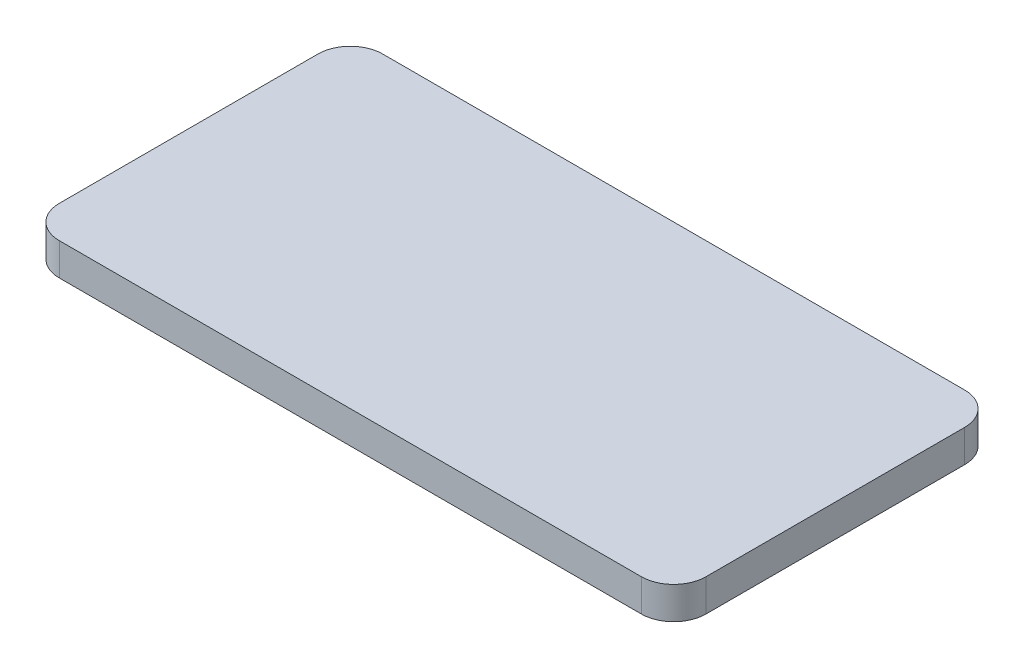
from build123d import *

# Parameters (mm, degrees)
BOSS_EXTRUDE1_DEPTH = 5
CUT_EXTRUDE1_DEPTH  = 1
SKETCH3_R           = 3.5
BOSS_EXTRUDE2_DEPTH = 2
CUT_EXTRUDE2_DEPTH  = 5


with BuildPart() as part:
    # Sketch1 → Boss-Extrude1 (new body)
    with BuildSketch(Plane(origin=(0, 0, 0), x_dir=(1, 0, 0), z_dir=(0, 1, 0))):
        with BuildLine():
            Line((-45, -25), (45, -25))
            ThreePointArc((45, -25), (48.535533906, -23.535533906), (50, -20))
            Line((50, -20), (50, 20))
            ThreePointArc((50, 20), (48.535533906, 23.535533906), (45, 25))
            Line((45, 25), (-45, 25))
            ThreePointArc((-45, 25), (-48.535533906, 23.535533906), (-50, 20))
            Line((-50, 20), (-50, -20))
            ThreePointArc((-50, -20), (-48.535533906, -23.535533906), (-45, -25))
        make_face()
    extrude(amount=BOSS_EXTRUDE1_DEPTH)

    # Sketch2 → Cut-Extrude1 (cut)
    with BuildSketch(Plane(origin=(0, 0, 0), x_dir=(-1, 0, 0), z_dir=(0, -1, 0))):
        with BuildLine():
            Line((-43.707715382, -20), (-30.707715382, -20))
            ThreePointArc((-30.707715382, -20), (-30.0006086, -19.707106781), (-29.707715382, -19))
            Line((-29.707715382, -19), (-29.707715382, -6))
            ThreePointArc((-29.707715382, -6), (-30.0006086, -5.292893219), (-30.707715382, -5))
            Line((-30.707715382, -5), (-43.707715382, -5))
            ThreePointArc((-43.707715382, -5), (-44.414822163, -5.292893219), (-44.707715382, -6))
            Line((-44.707715382, -6), (-44.707715382, -19))
            ThreePointArc((-44.707715382, -19), (-44.414822163, -19.707106781), (-43.707715382, -20))
        make_face()
    extrude(amount=-CUT_EXTRUDE1_DEPTH, mode=Mode.SUBTRACT)

    # Sketch3 → Boss-Extrude2 (add)
    with BuildSketch(Plane(origin=(0, 1, 0), x_dir=(-1, 0, 0), z_dir=(0, -1, 0))):
        with Locations(Location((-37.914895337, -8.755915312, 0), (0, 0, 270))):
            Circle(SKETCH3_R)
        with Locations(Location((-34.024612955, -14.842826033, 0), (0, 0, 270))):
            Circle(SKETCH3_R)
        with Locations(Location((-41.209446078, -15.261216115, 0), (0, 0, 181.801905024))):
            Circle(SKETCH3_R)
    extrude(amount=BOSS_EXTRUDE2_DEPTH)

    # Sketch4 → Cut-Extrude2 (cut)
    with BuildSketch(Plane.ZY.offset(50)):
        with BuildLine():
            Line((2, 1.770486386), (-2, 1.770486386))
            ThreePointArc((-2, 1.770486386), (-2.353553391, 1.916932996), (-2.5, 2.270486386))
            Line((-2.5, 2.270486386), (-2.5, 3.270486386))
            ThreePointArc((-2.5, 3.270486386), (-2.353553391, 3.624039777), (-2, 3.770486386))
            Line((-2, 3.770486386), (2, 3.770486386))
            ThreePointArc((2, 3.770486386), (2.353553391, 3.624039777), (2.5, 3.270486386))
            Line((2.5, 3.270486386), (2.5, 2.270486386))
            ThreePointArc((2.5, 2.270486386), (2.353553391, 1.916932996), (2, 1.770486386))
        make_face()
    extrude(amount=-CUT_EXTRUDE2_DEPTH, mode=Mode.SUBTRACT)


solid = part.part
